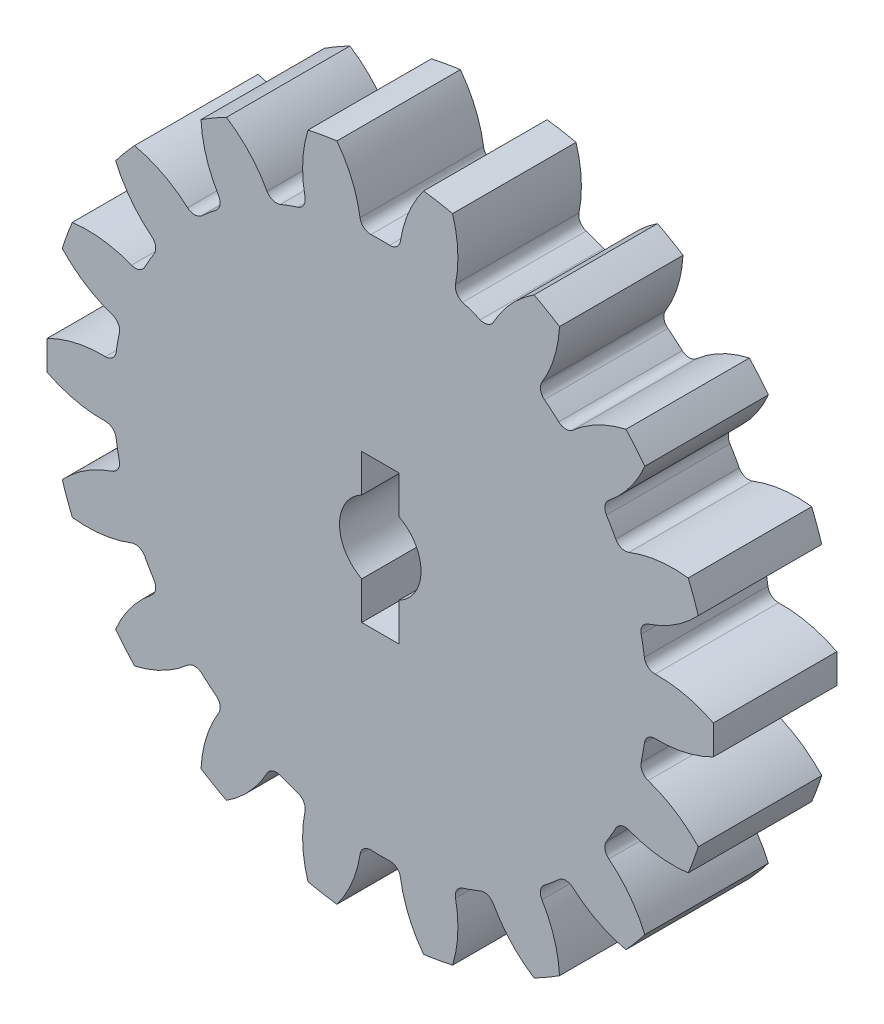
from build123d import *

# Parameters (mm, degrees)
SKETCH1_R                      = 13.5
BOSS_EXTRUDE1_DEPTH            = 2.5
CUT_EXTRUDE1_DEPTH             = 20.254869514
FILLET2_R                      = 0.43
CIRPATTERN1_COUNT              = 18
FILLET2_OF_CIRPATTERN1_R       = 0.43
THROUGH_CENTER_HOLE_DEPTH      = 20.17470347
THROUGH_CENTER_HOLE_DEPTH_BACK = 20.17470347


with BuildPart() as part:
    # Sketch1 → Boss-Extrude1 (new, symmetric)
    with BuildSketch(Plane.XY):
        Circle(SKETCH1_R)
    extrude(amount=BOSS_EXTRUDE1_DEPTH, both=True)

    # Sketch3 → Cut-Extrude1 (cut, symmetric)
    with BuildSketch(Plane.XY):
        with BuildLine():
            ThreePointArc((1.755207316, 13.385411734), (1.075923346, 12.149708729), (0.774539539, 10.772190516))
            ThreePointArc((0.774539539, 10.772190516), (0, 10.8), (-0.774539539, 10.772190516))
            ThreePointArc((-0.774539539, 10.772190516), (-1.075923346, 12.149708729), (-1.755207316, 13.385411734))
            ThreePointArc((-1.755207316, 13.385411734), (0, 13.5), (1.755207316, 13.385411734))
        make_face()
    cut_extrude1 = extrude(amount=CUT_EXTRUDE1_DEPTH, both=True, mode=Mode.SUBTRACT)

    # Fillet2
    fillet2_edges = [part.edges().sort_by_distance(p)[0] for p in [
        (-0.774539539, 10.772190516, 0),
        (0.774539539, 10.772190516, 0),
    ]]
    fillet(fillet2_edges, radius=FILLET2_R)

    # CirPattern1: Cut-Extrude1 ×18 about axis
    cirpattern1_axis = Axis((0, 0, 0), (0, 0, 1))
    for i in range(1, CIRPATTERN1_COUNT):
        add(cut_extrude1.rotate(cirpattern1_axis, i * 360 / CIRPATTERN1_COUNT), mode=Mode.SUBTRACT)

    # Fillet2 of CirPattern1
    fillet2_of_cirpattern1_edges = [part.edges().sort_by_distance(p)[0] for p in [
        (-4.412135233, 9.857639813, 0),
        (-2.956477055, 10.387456061, 0),
        (-7.517562302, 7.754112266, 0),
        (-6.330898883, 8.749841104, 0),
        (-9.71626041, 4.715324341, 0),
        (-8.941720871, 6.056866175, 0),
        (-10.743034116, 1.107798709, 0),
        (-10.474039357, 2.633343796, 0),
        (-10.474039357, -2.633343796, 0),
        (-10.743034116, -1.107798709, 0),
        (-8.941720871, -6.056866175, 0),
        (-9.71626041, -4.715324341, 0),
        (-6.330898883, -8.749841104, 0),
        (-7.517562302, -7.754112266, 0),
        (-2.956477055, -10.387456061, 0),
        (-4.412135233, -9.857639813, 0),
        (0.774539539, -10.772190516, 0),
        (-0.774539539, -10.772190516, 0),
        (4.412135233, -9.857639813, 0),
        (2.956477055, -10.387456061, 0),
        (7.517562302, -7.754112266, 0),
        (6.330898883, -8.749841104, 0),
        (9.71626041, -4.715324341, 0),
        (8.941720871, -6.056866175, 0),
        (10.743034116, -1.107798709, 0),
        (10.474039357, -2.633343796, 0),
        (10.474039357, 2.633343796, 0),
        (10.743034116, 1.107798709, 0),
        (8.941720871, 6.056866175, 0),
        (9.71626041, 4.715324341, 0),
        (6.330898883, 8.749841104, 0),
        (7.517562302, 7.754112266, 0),
        (2.956477055, 10.387456061, 0),
        (4.412135233, 9.857639813, 0),
    ]]
    fillet(fillet2_of_cirpattern1_edges, radius=FILLET2_OF_CIRPATTERN1_R)

    # Sketch4 → Through_Center_Hole (cut, two sides: drawn at the far end of the back side and taken through both)
    with BuildSketch(Plane.XY.offset(-THROUGH_CENTER_HOLE_DEPTH_BACK)):
        with BuildLine():
            Line((-0.75, 3), (0.75, 3))
            Line((0.75, 3), (0.75, 1.469693846))
            ThreePointArc((0.75, 1.469693846), (1.65, 0), (0.75, -1.469693846))
            Line((0.75, -1.469693846), (0.75, -3))
            Line((0.75, -3), (-0.75, -3))
            Line((-0.75, -3), (-0.75, -1.469693846))
            ThreePointArc((-0.75, -1.469693846), (-1.65, 0), (-0.75, 1.469693846))
            Line((-0.75, 1.469693846), (-0.75, 3))
        make_face()
    extrude(amount=THROUGH_CENTER_HOLE_DEPTH + THROUGH_CENTER_HOLE_DEPTH_BACK, mode=Mode.SUBTRACT)


solid = part.part
